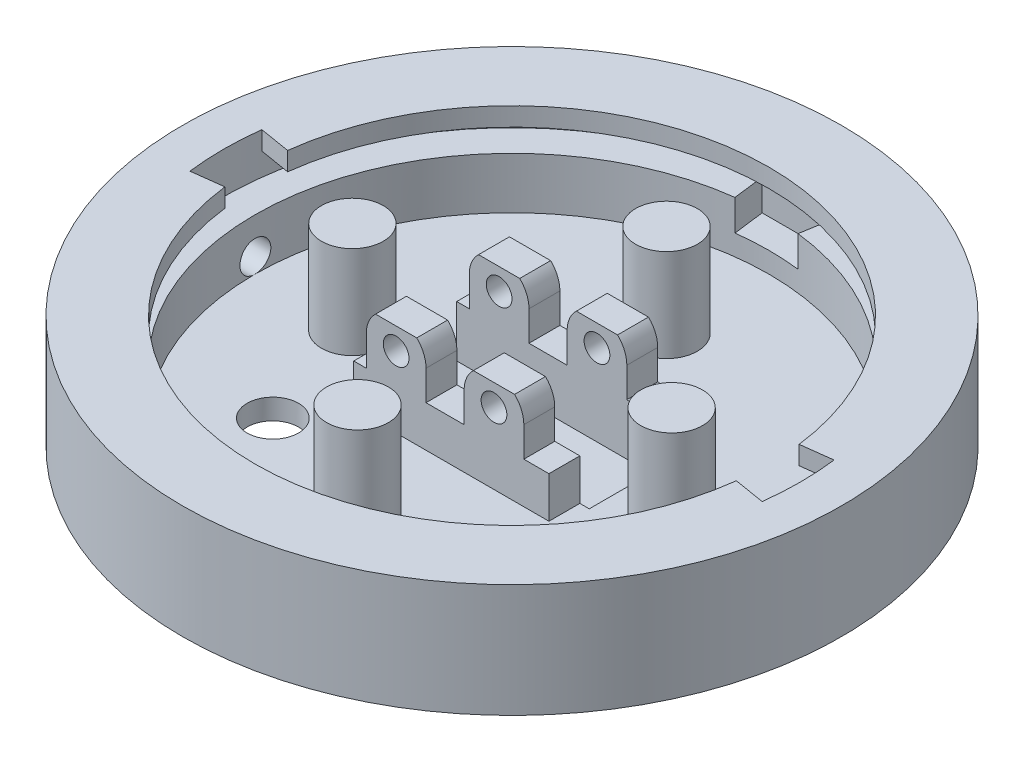
from build123d import *

# Parameters (mm, degrees)
SKETCH1_R                = 30
BOSS_EXTRUDE1_DEPTH      = 20
SKETCH2_R                = 28
CUT_EXTRUDE1_DEPTH       = 10
CUT_EXTRUDE2_DEPTH       = 6.5
CUT_EXTRUDE2_DEPTH_BACK  = 5
BOSS_EXTRUDE2_DEPTH      = 6.5
BOSS_EXTRUDE2_DEPTH_BACK = 6.5
SKETCH4_R                = 1.25
SKETCH5_W                = 22
SKETCH5_H                = 7
CUT_EXTRUDE4_DEPTH       = 8.5
SKETCH8_R                = 3
BOSS_EXTRUDE3_DEPTH      = 10
SKETCH9_R                = 30
CUT_EXTRUDE6_DEPTH       = 4
BOSS_EXTRUDE4_DEPTH      = 7
BOSS_EXTRUDE4_2_DEPTH    = 7
CUT_EXTRUDE7_START       = -5
SKETCH12_R               = 30
CUT_EXTRUDE7_DEPTH       = 5
SKETCH13_R               = 28
SKETCH13_R_2             = 12
CUT_EXTRUDE8_DEPTH       = 4
BOSS_EXTRUDE5_DEPTH      = 9
SKETCH24_W               = 4.419198498
SKETCH24_H               = 2.2
CUT_EXTRUDE9_DEPTH       = 4
CUT_EXTRUDE10_DEPTH      = 3
BOSS_EXTRUDE6_DEPTH      = 5
SKETCH34_R               = 3
BOSS_EXTRUDE7_DEPTH      = 9
CUT_EXTRUDE12_DEPTH      = 53
CUT_EXTRUDE12_DEPTH_BACK = 41
SKETCH35_R               = 1.5
SKETCH37_R               = 3
BOSS_EXTRUDE9_DEPTH      = 9
SKETCH38_R               = 2.5
CUT_EXTRUDE13_DEPTH      = 10
CUT_EXTRUDE14_DEPTH      = 5
SKETCH41_W               = 2
SKETCH41_H               = 13
CUT_EXTRUDE17_DEPTH      = 5
SKETCH43_R               = 32
SKETCH43_R_2             = 30
BOSS_EXTRUDE10_DEPTH     = 11


with BuildPart() as part:
    # Sketch1 → Boss-Extrude1 (new body)
    with BuildSketch(Plane(origin=(0, 0, 0), x_dir=(1, 0, 0), z_dir=(0, 1, 0))):
        with Locations(Location((0, 0, 0), (0, 0, 270))):
            Circle(SKETCH1_R)
    extrude(amount=BOSS_EXTRUDE1_DEPTH)

    # Sketch2 → Cut-Extrude1 (cut)
    with BuildSketch(Plane(origin=(0, 20, 0), x_dir=(1, 0, 0), z_dir=(0, 1, 0))):
        with Locations(Location((0, 0, 0), (0, 0, 270))):
            Circle(SKETCH2_R)
    extrude(amount=-CUT_EXTRUDE1_DEPTH, mode=Mode.SUBTRACT)

    # Sketch3 → Cut-Extrude2 (cut, two sides: drawn at the far end of the back side and taken through both)
    with BuildSketch(Plane(origin=(0, 10, 0), x_dir=(1, 0, 0), z_dir=(0, 1, 0)).offset(-CUT_EXTRUDE2_DEPTH_BACK)):
        Polygon((0, -3.5), (0, 0), (0, 3.5), (-11, 3.5), (-11, -3.5), align=None)
        Polygon((0, 3.5), (0, 0), (0, -3.5), (11, -3.5), (11, 3.5), align=None)
    extrude(amount=CUT_EXTRUDE2_DEPTH + CUT_EXTRUDE2_DEPTH_BACK, mode=Mode.SUBTRACT)

    # Sketch4 → Boss-Extrude2 (add, two sides: drawn at the far end of the back side and taken through both)
    # profile 1 of 2: a face of its own
    with BuildSketch(Plane.XY.offset(-BOSS_EXTRUDE2_DEPTH_BACK)):
        with BuildLine():
            Line((-1.85, 12.9), (-1.85, 10))
            Line((-1.85, 10), (-4.75, 10))
            Line((-4.75, 10), (-7.65, 10))
            Line((-7.65, 10), (-7.65, 12.9))
            ThreePointArc((-7.65, 12.9), (-4.75, 15.8), (-1.85, 12.9))
        make_face()
        with Locations((-4.75, 12.9)):
            Circle(SKETCH4_R, mode=Mode.SUBTRACT)
    # profile 2 of 2: a face of its own
    with BuildSketch(Plane.XY.offset(-BOSS_EXTRUDE2_DEPTH_BACK)):
        with BuildLine():
            Line((7.65, 12.9), (7.65, 10))
            Line((7.65, 10), (1.85, 10))
            Line((1.85, 10), (1.85, 12.9))
            ThreePointArc((1.85, 12.9), (4.75, 15.8), (7.65, 12.9))
        make_face()
        with Locations((4.75, 12.9)):
            Circle(SKETCH4_R, mode=Mode.SUBTRACT)
    extrude(amount=BOSS_EXTRUDE2_DEPTH + BOSS_EXTRUDE2_DEPTH_BACK)

    # Sketch5 → Cut-Extrude4 (cut)
    with BuildSketch(Plane(origin=(0, 10, 0), x_dir=(1, 0, 0), z_dir=(0, 1, 0))):
        Rectangle(SKETCH5_W, SKETCH5_H)
    extrude(amount=CUT_EXTRUDE4_DEPTH, mode=Mode.SUBTRACT)

    # Sketch8 → Boss-Extrude3 (add)
    with BuildSketch(Plane(origin=(0, 10, 0), x_dir=(1, 0, 0), z_dir=(0, 1, 0))):
        with Locations(Location((0, 15, 0), (0, 0, 270))):
            Circle(SKETCH8_R)
        with Locations(Location((0, -15, 0), (0, 0, 270))):
            Circle(SKETCH8_R)
    extrude(amount=BOSS_EXTRUDE3_DEPTH)

    # Sketch9 → Cut-Extrude6 (cut)
    with BuildSketch(Plane.XZ):
        with Locations(Location((0, 0, 0), (0, 0, 270))):
            Circle(SKETCH9_R)
    extrude(amount=-CUT_EXTRUDE6_DEPTH, mode=Mode.SUBTRACT)


with BuildPart() as body_2:
    # Sketch11 → Boss-Extrude4 (new body)
    with BuildSketch(Plane(origin=(0, 20, 0), x_dir=(1, 0, 0), z_dir=(0, 1, 0))):
        with BuildLine():
            Line((-24.766462704, -3.114084205), (-27.78125, -3.493157374))
            ThreePointArc((-27.78125, -3.493157374), (0, -28), (27.78125, -3.493157374))
            Line((27.78125, -3.493157374), (24.78125, -2.994134892))
            ThreePointArc((24.78125, -2.994134892), (0.060428681, -24.961401076), (-24.766462704, -3.114084205))
        make_face()
    extrude(amount=-BOSS_EXTRUDE4_DEPTH)


with BuildPart() as body_3:
    # Sketch11 → Boss-Extrude4 2 (new body)
    with BuildSketch(Plane(origin=(0, 20, 0), x_dir=(1, 0, 0), z_dir=(0, 1, 0))):
        with BuildLine():
            ThreePointArc((27.78125, 3.493157374), (0, 28), (-27.78125, 3.493157374))
            Line((-27.78125, 3.493157374), (-24.78125, 2.994134892))
            ThreePointArc((-24.78125, 2.994134892), (-0.060428681, 24.961401076), (24.766462704, 3.114084205))
            Line((24.766462704, 3.114084205), (27.78125, 3.493157374))
        make_face()
    extrude(amount=-BOSS_EXTRUDE4_2_DEPTH)


with BuildPart() as cut_extrude7_tool:
    # Sketch12 → Cut-Extrude7 (new body)
    with BuildSketch(Plane(origin=(0, 20, 0), x_dir=(1, 0, 0), z_dir=(0, 1, 0)).offset(CUT_EXTRUDE7_START)):
        with Locations(Location((0, 0, 0), (0, 0, 90))):
            Circle(SKETCH12_R)
    extrude(amount=CUT_EXTRUDE7_DEPTH)


with BuildPart() as part_1:
    add(part.part)

    # Cut-Extrude7: cut by cut_extrude7_tool
    add(cut_extrude7_tool.part, mode=Mode.SUBTRACT)

    # Sketch13 → Cut-Extrude8 (cut)
    with BuildSketch(Plane(origin=(0, 10, 0), x_dir=(1, 0, 0), z_dir=(0, 1, 0))):
        with Locations(Location((0, 0, 0), (0, 0, 270))):
            Circle(SKETCH13_R)
        with Locations(Location((0, 0, 0), (0, 0, 270))):
            Circle(SKETCH13_R_2, mode=Mode.SUBTRACT)
    extrude(amount=-CUT_EXTRUDE8_DEPTH, mode=Mode.SUBTRACT)


with BuildPart() as body_2_1:
    add(body_2.part)

    # Cut-Extrude7: cut by cut_extrude7_tool
    add(cut_extrude7_tool.part, mode=Mode.SUBTRACT)



with BuildPart() as body_3_1:
    add(body_3.part)

    # Cut-Extrude7: cut by cut_extrude7_tool
    add(cut_extrude7_tool.part, mode=Mode.SUBTRACT)


with BuildPart() as cut_extrude8_piece_1:
    # of the separate pieces the step leaves, piece 1, a body of its own (cut_extrude8_pieces)
    add(part_1.part.solids().sort_by_distance((0, 4, 30))[0])


with BuildPart() as cut_extrude8_piece_2:
    # of the separate pieces the step leaves, piece 2, a body of its own (cut_extrude8_pieces)
    add(part_1.part.solids().sort_by_distance((0, 10, 18))[0])


with BuildPart() as cut_extrude8_piece_3:
    # of the separate pieces the step leaves, piece 3, a body of its own (cut_extrude8_pieces)
    add(part_1.part.solids().sort_by_distance((0, 15, -12))[0])


with BuildPart() as body_2_2:
    add(body_2_1.part)

    add(body_3_1.part)  # Boss-Extrude5 merges body 3

    add(cut_extrude8_piece_1.part)  # Boss-Extrude5 merges Cut-Extrude8 piece 1
    # Sketch16 → Boss-Extrude5 (add)
    with BuildSketch(Plane(origin=(0, 15, 0), x_dir=(1, 0, 0), z_dir=(0, 1, 0))):
        with BuildLine():
            Line((-27.78125, -3.493157374), (-24.766462704, -3.114084205))
            ThreePointArc((-24.766462704, -3.114084205), (0.060428681, -24.961401076), (24.78125, -2.994134892))
            Line((24.78125, -2.994134892), (27.78125, -3.493157374))
            ThreePointArc((27.78125, -3.493157374), (0, -28), (-27.78125, -3.493157374))
        make_face()
        with BuildLine():
            Line((-27.78125, 3.493157374), (-24.78125, 2.994134892))
            ThreePointArc((-24.78125, 2.994134892), (-0.060428681, 24.961401076), (24.766462704, 3.114084205))
            Line((24.766462704, 3.114084205), (27.78125, 3.493157374))
            ThreePointArc((27.78125, 3.493157374), (0, 28), (-27.78125, 3.493157374))
        make_face()
    extrude(amount=-BOSS_EXTRUDE5_DEPTH)

    # Cut-Sweep2: sweep along a path in Sketch17
    with BuildLine(Plane(origin=(0, 11, 0), x_dir=(1, 0, 0), z_dir=(0, 1, 0))) as cut_sweep2_path:
        CenterArc((0, 0), 26.48, 0, 360)
    # Sketch24 → Cut-Sweep2 (sweep, cut)
    with BuildSketch(Plane.XY):
        with Locations((-25.790400751, 12.1)):
            Rectangle(SKETCH24_W, SKETCH24_H)
    sweep(path=cut_sweep2_path.line, mode=Mode.SUBTRACT)

    # Sketch15 → Cut-Extrude9 (cut)
    with BuildSketch(Plane(origin=(0, 10, 0), x_dir=(1, 0, 0), z_dir=(0, 1, 0))):
        with BuildLine():
            Line((-7.65, -6.5), (-10.087120501, -6.5))
            ThreePointArc((-10.087120501, -6.5), (0, -12), (10.087120501, -6.5))
            Line((10.087120501, -6.5), (7.65, -6.5))
            Line((7.65, -6.5), (1.85, -6.5))
            Line((1.85, -6.5), (-1.85, -6.5))
            Line((-1.85, -6.5), (-7.65, -6.5))
        make_face()
        with BuildLine():
            Line((-10.087120501, 6.5), (-7.65, 6.5))
            Line((-7.65, 6.5), (-1.85, 6.5))
            Line((-1.85, 6.5), (1.85, 6.5))
            Line((1.85, 6.5), (7.65, 6.5))
            Line((7.65, 6.5), (10.087120501, 6.5))
            ThreePointArc((10.087120501, 6.5), (0, 12), (-10.087120501, 6.5))
        make_face()
    extrude(amount=-CUT_EXTRUDE9_DEPTH, mode=Mode.SUBTRACT)

    # Sketch32 → Cut-Extrude10 (cut)
    with BuildSketch(Plane(origin=(0, 11, 0), x_dir=(1, 0, 0), z_dir=(0, 1, 0))):
        Polygon((3.114084205, -24.766462704), (-2.994134892, -24.78125), (-3.493157374, -27.78125), (3.493157374, -27.78125), align=None)
        Polygon((-3.114084205, 24.766462704), (2.994134892, 24.78125), (3.493157374, 27.78125), (-3.493157374, 27.78125), align=None)
    extrude(amount=-CUT_EXTRUDE10_DEPTH, mode=Mode.SUBTRACT)

    # Sketch33 → Boss-Extrude6 (add)
    with BuildSketch(Plane(origin=(0, 11, 0), x_dir=(1, 0, 0), z_dir=(0, 1, 0))):
        with BuildLine():
            Line((-24.78125, 2.994134892), (-27.78125, 3.493157374))
            ThreePointArc((-27.78125, 3.493157374), (-28, 0), (-27.78125, -3.493157374))
            Line((-27.78125, -3.493157374), (-24.766462704, -3.114084205))
            ThreePointArc((-24.766462704, -3.114084205), (-24.961401076, -0.060428681), (-24.78125, 2.994134892))
        make_face()
        with BuildLine():
            Line((24.766462704, 3.114084205), (27.78125, 3.493157374))
            ThreePointArc((27.78125, 3.493157374), (28, 0), (27.78125, -3.493157374))
            Line((27.78125, -3.493157374), (24.78125, -2.994134892))
            ThreePointArc((24.78125, -2.994134892), (24.961401076, 0.060428681), (24.766462704, 3.114084205))
        make_face()
    extrude(amount=-BOSS_EXTRUDE6_DEPTH)


    add(cut_extrude8_piece_2.part)  # Boss-Extrude7 merges Cut-Extrude8 piece 2

    add(cut_extrude8_piece_3.part)  # Boss-Extrude7 merges Cut-Extrude8 piece 3
    # Sketch34 → Boss-Extrude7 (add)
    with BuildSketch(Plane(origin=(0, 15, 0), x_dir=(1, 0, 0), z_dir=(0, 1, 0))):
        with Locations(Location((0, 15, 0), (0, 0, 270))):
            Circle(SKETCH34_R)
        with Locations(Location((0, -15, 0), (0, 0, 270))):
            Circle(SKETCH34_R)
    extrude(amount=-BOSS_EXTRUDE7_DEPTH)

    # Sketch35 → Cut-Extrude12 (cut, two sides: drawn at the far end of the back side and taken through both)
    with BuildSketch(Plane(origin=(-11, 0, 0), x_dir=(0, 0, -1), z_dir=(1, 0, 0)).offset(-CUT_EXTRUDE12_DEPTH_BACK)):
        with Locations(Location((0, 7.5, 0), (0, 0, 270))):
            Circle(SKETCH35_R)
    extrude(amount=CUT_EXTRUDE12_DEPTH + CUT_EXTRUDE12_DEPTH_BACK, mode=Mode.SUBTRACT)

    # Sketch37 → Boss-Extrude9 (add)
    with BuildSketch(Plane(origin=(0, 6, 0), x_dir=(1, 0, 0), z_dir=(0, 1, 0))):
        with Locations(Location((-15.5, 0, 0), (0, 0, 270))):
            Circle(SKETCH37_R)
        with Locations(Location((15.5, 0, 0), (0, 0, 270))):
            Circle(SKETCH37_R)
    extrude(amount=BOSS_EXTRUDE9_DEPTH)

    # Sketch38 → Cut-Extrude13 (cut)
    with BuildSketch(Plane(origin=(0, 6, 0), x_dir=(1, 0, 0), z_dir=(0, 1, 0))):
        with Locations(Location((-11.98857587, -11.234327719, 0), (0, 0, 270))):
            Circle(SKETCH38_R)
    extrude(amount=-CUT_EXTRUDE13_DEPTH, mode=Mode.SUBTRACT)

    # Sketch39 → Cut-Extrude14 (cut)
    with BuildSketch(Plane(origin=(0, 6, 0), x_dir=(1, 0, 0), z_dir=(0, 1, 0))):
        with BuildLine():
            Line((12.318162743, 6.5), (12.318162743, -6.5))
            Line((12.318162743, -6.5), (10.087120501, -6.5))
            ThreePointArc((10.087120501, -6.5), (11.511851415, -3.387813011), (12, 0))
            ThreePointArc((12, 0), (11.511851415, 3.387813011), (10.087120501, 6.5))
            Line((10.087120501, 6.5), (12.318162743, 6.5))
        make_face()
        with BuildLine():
            Line((-10.087120501, -6.5), (-8.86856025, -6.5))
            Line((-8.86856025, -6.5), (-8.86856025, 6.5))
            Line((-8.86856025, 6.5), (-10.087120501, 6.5))
            ThreePointArc((-10.087120501, 6.5), (-11.511851415, 3.387813011), (-12, 0))
            ThreePointArc((-12, 0), (-11.511851415, -3.387813011), (-10.087120501, -6.5))
        make_face()
        with BuildLine():
            Line((-11.593391463, -6.5), (-10.087120501, -6.5))
            ThreePointArc((-10.087120501, -6.5), (-11.511851415, -3.387813011), (-12, 0))
            Line((-12, 0), (-12, -6.5))
            Line((-12, -6.5), (-11.593391463, -6.5))
        make_face()
    extrude(amount=CUT_EXTRUDE14_DEPTH, mode=Mode.SUBTRACT)

    # Sketch41 → Cut-Extrude17 (cut)
    with BuildSketch(Plane(origin=(0, 6, 0), x_dir=(1, 0, 0), z_dir=(0, 1, 0))):
        with Locations((11.087120501, 0)):
            Rectangle(SKETCH41_W, SKETCH41_H)
    extrude(amount=CUT_EXTRUDE17_DEPTH, mode=Mode.SUBTRACT)

    # Sketch43 → Boss-Extrude10 (add)
    with BuildSketch(Plane(origin=(0, 4, 0), x_dir=(-1, 0, 0), z_dir=(0, -1, 0))):
        with Locations(Location((0, 0, 0), (0, 0, 90))):
            Circle(SKETCH43_R)
        Circle(SKETCH43_R_2, mode=Mode.SUBTRACT)
    extrude(amount=-BOSS_EXTRUDE10_DEPTH)


solid = body_2_2.part
